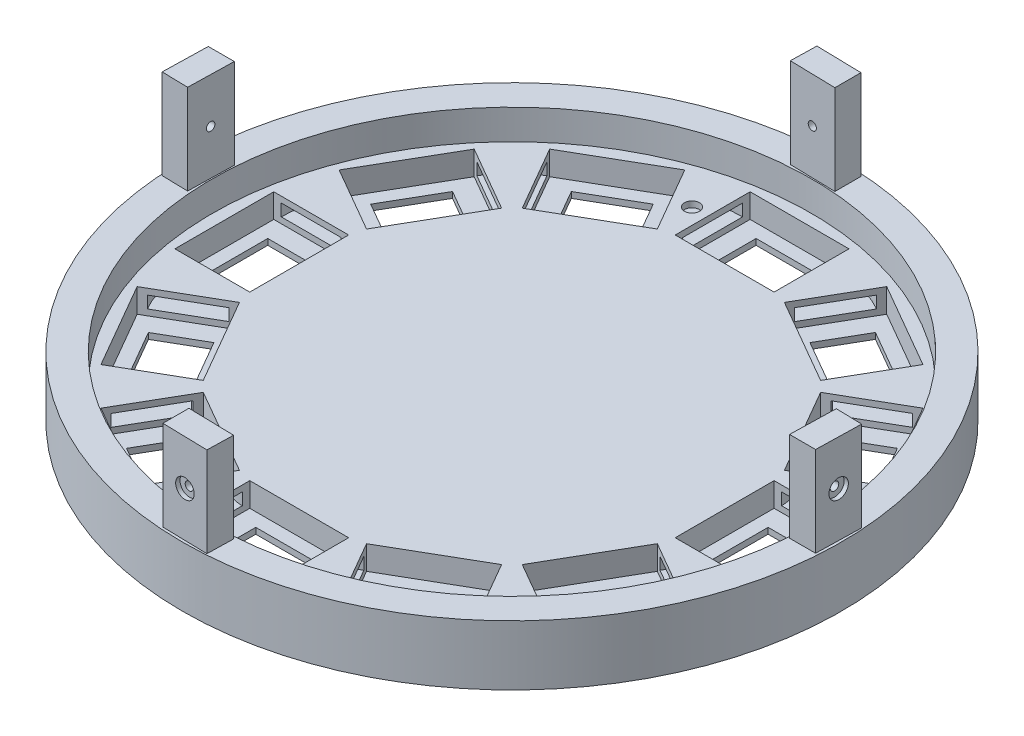
from build123d import *

# Parameters (mm, degrees)
SKETCH2_R           = 55
BOSS_EXTRUDE1_DEPTH = 10
SKETCH3_R           = 50
CUT_EXTRUDE1_DEPTH  = 5
SKETCH4_W           = 16.5
SKETCH4_H           = 12.5
SKETCH4_W_2         = 12.5
SKETCH4_H_2         = 16.5
CUT_EXTRUDE2_DEPTH  = 4
SKETCH6_W           = 10
SKETCH6_H           = 8
CUT_EXTRUDE3_DEPTH  = 79.300702423
CIRPATTERN1_COUNT   = 12
SKETCH7_W           = 10
SKETCH7_H           = 2.006854622
CUT_REVOLVE1_ANGLE  = 31
CIRPATTERN8_COUNT   = 12
CUT_EXTRUDE4_REACH  = 79.942
SKETCH10_R          = 1.25
BOSS_EXTRUDE2_DEPTH = 15
CIRPATTERN9_COUNT   = 4
CIRPATTERN10_COUNT  = 4


with BuildPart() as part:
    # Sketch2 → Boss-Extrude1 (new body)
    with BuildSketch(Plane(origin=(0, 0, 0), x_dir=(1, 0, 0), z_dir=(0, 1, 0))):
        Circle(SKETCH2_R)
    extrude(amount=BOSS_EXTRUDE1_DEPTH)

    # Sketch3 → Cut-Extrude1 (cut)
    with BuildSketch(Plane(origin=(0, 10, 0), x_dir=(1, 0, 0), z_dir=(0, 1, 0))):
        Circle(SKETCH3_R)
    extrude(amount=-CUT_EXTRUDE1_DEPTH, mode=Mode.SUBTRACT)

    # Sketch4 → Cut-Extrude2 (cut)
    with BuildSketch(Plane(origin=(0, 5, 0), x_dir=(1, 0, 0), z_dir=(0, 1, 0))):
        with Locations((0, 41.75)):
            Rectangle(SKETCH4_W, SKETCH4_H)
        Polygon((16.855290419, 45.694219382), (10.605290419, 34.868901834), (24.894709581, 26.618901834), (31.144709581, 37.444219382), align=None)
        Polygon((37.444219382, 31.144709581), (26.618901834, 24.894709581), (34.868901834, 10.605290419), (45.694219382, 16.855290419), align=None)
        with Locations((41.75, 0)):
            Rectangle(SKETCH4_W_2, SKETCH4_H_2)
        Polygon((45.694219382, -16.855290419), (34.868901834, -10.605290419), (26.618901834, -24.894709581), (37.444219382, -31.144709581), align=None)
        Polygon((31.144709581, -37.444219382), (24.894709581, -26.618901834), (10.605290419, -34.868901834), (16.855290419, -45.694219382), align=None)
        with Locations((0, -41.75)):
            Rectangle(SKETCH4_W, SKETCH4_H)
        Polygon((-16.855290419, -45.694219382), (-10.605290419, -34.868901834), (-24.894709581, -26.618901834), (-31.144709581, -37.444219382), align=None)
        Polygon((-37.444219382, -31.144709581), (-26.618901834, -24.894709581), (-34.868901834, -10.605290419), (-45.694219382, -16.855290419), align=None)
        with Locations((-41.75, 0)):
            Rectangle(SKETCH4_W_2, SKETCH4_H_2)
        Polygon((-45.694219382, 16.855290419), (-34.868901834, 10.605290419), (-26.618901834, 24.894709581), (-37.444219382, 31.144709581), align=None)
        Polygon((-31.144709581, 37.444219382), (-24.894709581, 26.618901834), (-10.605290419, 34.868901834), (-16.855290419, 45.694219382), align=None)
    extrude(amount=-CUT_EXTRUDE2_DEPTH, mode=Mode.SUBTRACT)

    # Sketch6 → Cut-Extrude3 (cut, through all)
    with BuildSketch(Plane(origin=(0, 1, 0), x_dir=(1, 0, 0), z_dir=(0, 1, 0))):
        with Locations((0, 41.75)):
            Rectangle(SKETCH6_W, SKETCH6_H)
    cut_extrude3 = extrude(amount=-CUT_EXTRUDE3_DEPTH, mode=Mode.SUBTRACT)

    # CirPattern1: Cut-Extrude3 ×12 about axis
    cirpattern1_axis = Axis((0, 5, 0), (0, 1, 0))
    for i in range(1, CIRPATTERN1_COUNT):
        add(cut_extrude3.rotate(cirpattern1_axis, i * 360 / CIRPATTERN1_COUNT), mode=Mode.SUBTRACT)

    # Sketch7 → Cut-Revolve1 (revolve, cut)
    with BuildSketch(Plane(origin=(-8.25, 0, 0), x_dir=(0, 0, -1), z_dir=(1, 0, 0))):
        with Locations((41.75, 3)):
            Rectangle(SKETCH7_W, SKETCH7_H)
    cut_revolve1 = revolve(axis=Axis((-8.25, 1, -30.789419162), (0, 1, 0)), revolution_arc=CUT_REVOLVE1_ANGLE, mode=Mode.SUBTRACT)

    # CirPattern8: Cut-Revolve1 ×12 about axis
    cirpattern8_axis = Axis((0, -0.5, 0), (0, 1, 0))
    for i in range(1, CIRPATTERN8_COUNT):
        add(cut_revolve1.rotate(cirpattern8_axis, i * 360 / CIRPATTERN8_COUNT), mode=Mode.SUBTRACT)

    # Sketch10 → Cut-Extrude4 (cut, up to next)
    with BuildSketch(Plane(origin=(0, 5, 0), x_dir=(1, 0, 0), z_dir=(0, 1, 0)), mode=Mode.PRIVATE) as cut_extrude4_sk1:
        with Locations((-10.894503574, 40.944573889)):
            Circle(SKETCH10_R)
    cut_extrude4_tool1 = extrude(cut_extrude4_sk1.sketch, amount=-CUT_EXTRUDE4_REACH, mode=Mode.PRIVATE) & part.part
    add(cut_extrude4_tool1.solids().sort_by_distance((-10.894504, 5, -40.944574))[0], mode=Mode.SUBTRACT)

    # Sketch11 → Boss-Extrude2 (add)
    with BuildSketch(Plane(origin=(0, 10, 0), x_dir=(1, 0, 0), z_dir=(0, 1, 0))):
        Polygon((50.290999025, 3.83481884), (50.114374509, -3.784473139), (54.460370549, -3.784473139), (54.634660915, 3.734127439), align=None)
    boss_extrude2 = extrude(amount=BOSS_EXTRUDE2_DEPTH)

    # CirPattern9: Boss-Extrude2 ×4 about axis
    cirpattern9_axis = Axis((0, -0.5, 0), (0, 1, 0))
    for i in range(1, CIRPATTERN9_COUNT):
        add(boss_extrude2.rotate(cirpattern9_axis, i * 360 / CIRPATTERN9_COUNT))

    # Sketch15 → CBORE for #00 Binding Head Machine Screw3 (revolve, cut)
    with BuildSketch(Plane(origin=(54.547515732, 17.5, 0.02517285), x_dir=(0.02317499837232957, 0, -0.9997314236585958), z_dir=(0, 1, 0))):
        Polygon((0, 0), (0, 7.919701142), (0.6985, 7.5), (0.6985, 0.7112), (1.5875, 0.7112), (1.5875, 0), align=None)
    cbore_for_00_binding_head_machine_screw = revolve(axis=Axis((60.895810272, 17.5, 0.17233409), (-0.9997314236585957, 0, -0.023174998372329565)), mode=Mode.SUBTRACT)

    # CirPattern10: CBORE for #00 Binding Head Machine Screw3 ×4 about axis
    cirpattern10_axis = Axis((0, -0.5, 0), (0, 1, 0))
    for i in range(1, CIRPATTERN10_COUNT):
        add(cbore_for_00_binding_head_machine_screw.rotate(cirpattern10_axis, i * 360 / CIRPATTERN10_COUNT), mode=Mode.SUBTRACT)


solid = part.part
